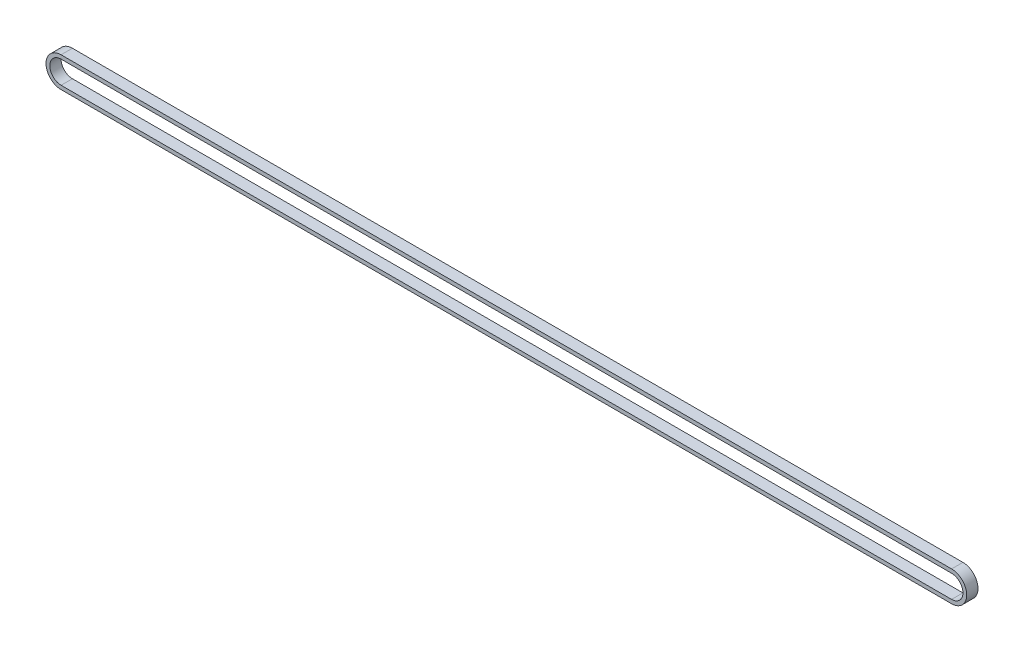
from build123d import *

# Parameters (mm, degrees)
BOSS_EXTRUDE1_DEPTH = 6


with BuildPart() as part:
    # Sketch1 → Boss-Extrude1 (new body)
    with BuildSketch(Plane.XY):
        with BuildLine():
            Line((236, 8), (-236, 8))
            ThreePointArc((-236, 8), (-244, 0), (-236, -8))
            Line((-236, -8), (236, -8))
            ThreePointArc((236, -8), (244, 0), (236, 8))
        make_face()
        with BuildLine():
            Line((-236, 6), (236, 6))
            ThreePointArc((236, 6), (242, 0), (236, -6))
            Line((236, -6), (-236, -6))
            ThreePointArc((-236, -6), (-242, 0), (-236, 6))
        make_face(mode=Mode.SUBTRACT)
    extrude(amount=BOSS_EXTRUDE1_DEPTH)


solid = part.part
